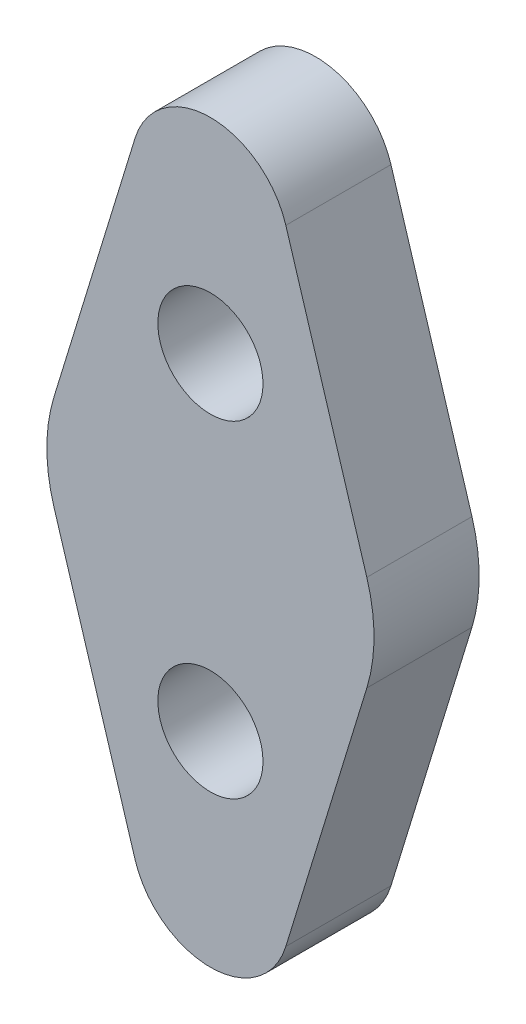
from build123d import *

# Parameters (mm, degrees)
CROQUIS2_R              = 5
SALIENTE_EXTRUIR2_DEPTH = 10


with BuildPart() as part:
    # Croquis2 → Saliente-Extruir2 (new body)
    with BuildSketch(Plane.XY):
        with BuildLine():
            Line((-14.873194883, 4.556675338), (-7.171006046, 29.696968886))
            ThreePointArc((-7.171006046, 29.696968886), (0, 35), (7.171006046, 29.696968886))
            Line((7.171006046, 29.696968886), (14.873194883, 4.556675338))
            ThreePointArc((14.873194883, 4.556675338), (15.555552583, 0), (14.873194883, -4.556675338))
            Line((14.873194883, -4.556675338), (7.171006046, -29.696968886))
            ThreePointArc((7.171006046, -29.696968886), (0, -35), (-7.171006046, -29.696968886))
            Line((-7.171006046, -29.696968886), (-14.873194883, -4.556675338))
            ThreePointArc((-14.873194883, -4.556675338), (-15.555552583, 0), (-14.873194883, 4.556675338))
        make_face()
        with Locations((0, 15.555552583)):
            Circle(CROQUIS2_R, mode=Mode.SUBTRACT)
        with Locations((0, -15.555552583)):
            Circle(CROQUIS2_R, mode=Mode.SUBTRACT)
    extrude(amount=SALIENTE_EXTRUIR2_DEPTH)


solid = part.part
